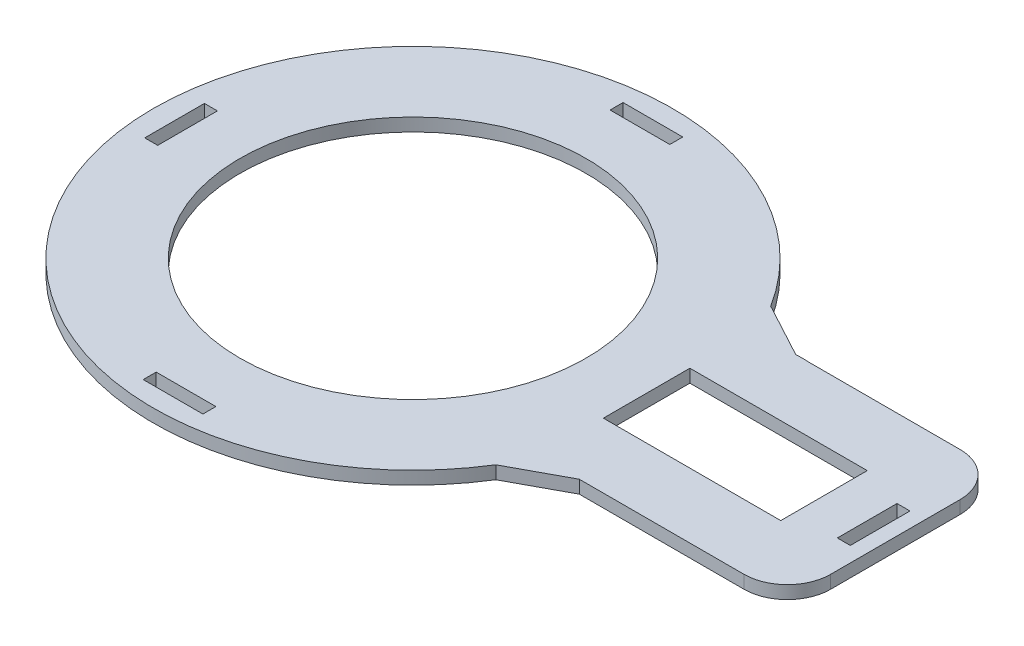
from build123d import *

# Parameters (mm, degrees)
EXTRUDE_1_DEPTH     = 3
SKETCH_3_W          = 13.8
SKETCH_3_H          = 3
SKETCH_3_W_2        = 3
SKETCH_3_H_2        = 13.8
CUT_EXTRUDE_1_DEPTH = 10
EXTRUDE_2_DEPTH     = 3
SKETCH_5_W          = 3
SKETCH_5_H          = 13.8
CUT_EXTRUDE_2_DEPTH = 20
SKETCH_6_W          = 41
SKETCH_6_H          = 20
CUT_EXTRUDE_3_DEPTH = 10
SKETCH_7_R          = 40
CUT_EXTRUDE_4_DEPTH = 3


with BuildPart() as part:
    # Эскиз2 → Бобышка-Вытянуть1 (new body)
    with BuildSketch(Plane(origin=(0, 0, 0), x_dir=(1, 0, 0), z_dir=(0, 1, 0))):
        with BuildLine():
            Line((50.901300831, -31.765666587), (63.52144012, -24.956238913))
            ThreePointArc((63.52144012, -24.956238913), (90, 0), (63.52144012, 24.956238913))
            Line((63.52144012, 24.956238913), (50.901300831, 31.765666587))
            ThreePointArc((50.901300831, 31.765666587), (-60, 0), (50.901300831, -31.765666587))
        make_face()
    extrude(amount=EXTRUDE_1_DEPTH)

    # Эскиз3 → Вырез-Вытянуть1 (cut)
    with BuildSketch(Plane(origin=(0, 3, 0), x_dir=(1, 0, 0), z_dir=(0, 1, 0))):
        with Locations((0, 53.956851754)):
            Rectangle(SKETCH_3_W, SKETCH_3_H)
        with Locations((0, -53.956851754)):
            Rectangle(SKETCH_3_W, SKETCH_3_H)
        with Locations((-53.60522772, 0)):
            Rectangle(SKETCH_3_W_2, SKETCH_3_H_2)
        with Locations((84.05982534, 0)):
            Rectangle(SKETCH_3_W_2, SKETCH_3_H_2)
    extrude(amount=-CUT_EXTRUDE_1_DEPTH, mode=Mode.SUBTRACT)

    # Эскиз4 → Бобышка-Вытянуть2 (add)
    with BuildSketch(Plane(origin=(0, 3, 0), x_dir=(1, 0, 0), z_dir=(0, 1, 0))):
        with BuildLine():
            Line((63.52144012, 24.956238913), (101.52144012, 24.956238913))
            ThreePointArc((101.52144012, 24.956238913), (108.592507932, 22.027306725), (111.52144012, 14.956238913))
            Line((111.52144012, 14.956238913), (111.52144012, -15))
            ThreePointArc((111.52144012, -15), (108.592507932, -22.071067812), (101.52144012, -25))
            Line((101.52144012, -25), (63.52144012, -25))
            Line((63.52144012, -25), (63.52144012, 24.956238913))
        make_face()
    extrude(amount=-EXTRUDE_2_DEPTH)

    # Эскиз5 → Вырез-Вытянуть2 (cut)
    with BuildSketch(Plane(origin=(0, 3, 0), x_dir=(1, 0, 0), z_dir=(0, 1, 0))):
        with Locations((106.52144012, -0.043761087)):
            Rectangle(SKETCH_5_W, SKETCH_5_H)
    extrude(amount=-CUT_EXTRUDE_2_DEPTH, mode=Mode.SUBTRACT)

    # Эскиз6 → Вырез-Вытянуть3 (cut)
    with BuildSketch(Plane(origin=(0, 3, 0), x_dir=(1, 0, 0), z_dir=(0, 1, 0))):
        with Locations((74.50144012, 0)):
            Rectangle(SKETCH_6_W, SKETCH_6_H)
    extrude(amount=-CUT_EXTRUDE_3_DEPTH, mode=Mode.SUBTRACT)

    # Эскиз7 → Вырез-Вытянуть4 (cut)
    with BuildSketch(Plane(origin=(0, 3, 0), x_dir=(1, 0, 0), z_dir=(0, 1, 0))):
        with Locations(Location((0, 0, 0), (0, 0, 270))):
            Circle(SKETCH_7_R)
    extrude(amount=-CUT_EXTRUDE_4_DEPTH, mode=Mode.SUBTRACT)


solid = part.part
